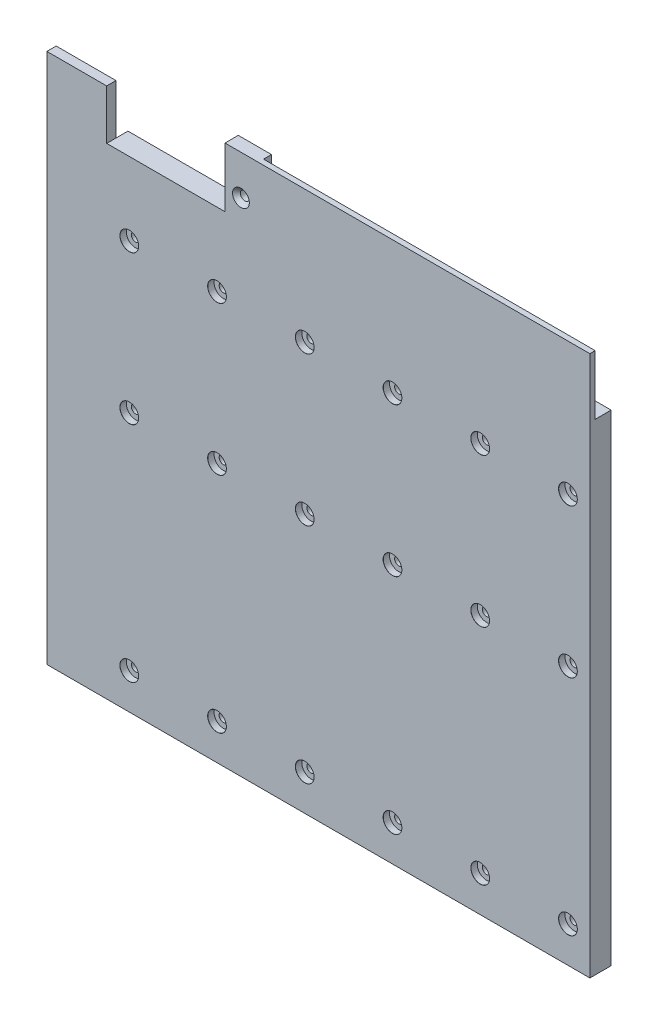
from build123d import *

# Parameters (mm, degrees)
ESQUISSE1_W                                    = 408.5
ESQUISSE1_H                                    = 181
BOSS_EXTRU_1_DEPTH                             = 8
CHAMBRAGE_POUR_VIS_T_TE_RONDE_BOMB_2_COUNT     = 2
CHAMBRAGE_POUR_VIS_T_TE_RONDE_BOMB_2_PITCH     = 56
CHAMBRAGE_POUR_VIS_T_TE_RONDE_BOMB_3_COUNT     = 2
CHAMBRAGE_POUR_VIS_T_TE_RONDE_BOMB_3_PITCH     = 140
R_P_TITION_LIN_AIRE1_COUNT                     = 11
R_P_TITION_LIN_AIRE1_PITCH                     = 33
ENL_V_MAT_EXTRU_1_REACH                        = 275.026
ESQUISSE6_W                                    = 22.5
ESQUISSE6_H                                    = 4.5
BOSS_EXTRU_2_START                             = -3.5
ESQUISSE7_W                                    = 22.5
ESQUISSE7_H                                    = 18.725
BOSS_EXTRU_2_DEPTH                             = 3.5
ESQUISSE8_W                                    = 274.5
ESQUISSE8_H                                    = 22.375
BOSS_EXTRU_3_DEPTH                             = 5
FRAISAGE_POUR_VIS_T_TE_FRAIS_E_M31_D           = 3.4
FRAISAGE_POUR_VIS_T_TE_FRAIS_E_M31_CSINK_D     = 6.3
FRAISAGE_POUR_VIS_T_TE_FRAIS_E_M31_CSINK_ANGLE = 90
ESQUISSE12_W                                   = 249.5
ESQUISSE12_H                                   = 22.375
ENL_V_MAT_EXTRU_2_DEPTH                        = 3
ESQUISSE13_W                                   = 204.25
ESQUISSE13_H                                   = 203.375
ENL_V_MAT_EXTRU_3_DEPTH                        = 10


with BuildPart() as part:
    # Esquisse1 → Boss.-Extru.1 (new body)
    with BuildSketch(Plane.XY):
        Rectangle(ESQUISSE1_W, ESQUISSE1_H)
    extrude(amount=BOSS_EXTRU_1_DEPTH)

    # Esquisse3 → Chambrage pour vis à tête ronde bombée M31 (revolve, cut)
    with BuildSketch(Plane(origin=(-173.25, 63, 8), x_dir=(0, -1, 0), z_dir=(1, 0, 0))):
        Polygon((0, 0), (0, 8), (1.6, 8), (1.6, 2.4), (3.5, 2.4), (3.5, 0.025), (3.525, 0), align=None)
    chambrage_pour_vis_t_te_ronde_bomb_e_m = revolve(axis=Axis((-173.25, 63, 14.35), (0, 0, -1)), mode=Mode.SUBTRACT)

    # Chambrage pour vis _ t_te ronde bomb 2: Chambrage pour vis à tête ronde bombée M31 ×2
    with Locations(*[(0, -i * CHAMBRAGE_POUR_VIS_T_TE_RONDE_BOMB_2_PITCH, 0) for i in range(1, CHAMBRAGE_POUR_VIS_T_TE_RONDE_BOMB_2_COUNT)]):
        add(chambrage_pour_vis_t_te_ronde_bomb_e_m, mode=Mode.SUBTRACT)

    # Chambrage pour vis _ t_te ronde bomb 3: Chambrage pour vis à tête ronde bombée M31 ×2
    with Locations(*[(0, -i * CHAMBRAGE_POUR_VIS_T_TE_RONDE_BOMB_3_PITCH, 0) for i in range(1, CHAMBRAGE_POUR_VIS_T_TE_RONDE_BOMB_3_COUNT)]):
        add(chambrage_pour_vis_t_te_ronde_bomb_e_m, mode=Mode.SUBTRACT)

    # Répétition linéaire1: Chambrage pour vis à tête ronde bombée M31 ×11
    with Locations(*[(i * R_P_TITION_LIN_AIRE1_PITCH, 0, 0) for i in range(1, R_P_TITION_LIN_AIRE1_COUNT)]):
        add(chambrage_pour_vis_t_te_ronde_bomb_e_m, mode=Mode.SUBTRACT)

    # Répétition linéaire1 copy 1 sketch → Répétition linéaire1 copy 1 (revolve, cut)
    with BuildSketch(Plane(origin=(-140.25, 7, 8), x_dir=(0, -1, 0), z_dir=(1, 0, 0))):
        Polygon((0, 0), (0, 8), (1.6, 8), (1.6, 2.4), (3.5, 2.4), (3.5, 0.025), (3.525, 0), align=None)
    revolve(axis=Axis((-140.25, 7, 14.35), (0, 0, -1)), mode=Mode.SUBTRACT)

    # Répétition linéaire1 copy 2 sketch → Répétition linéaire1 copy 2 (revolve, cut)
    with BuildSketch(Plane(origin=(-107.25, 7, 8), x_dir=(0, -1, 0), z_dir=(1, 0, 0))):
        Polygon((0, 0), (0, 8), (1.6, 8), (1.6, 2.4), (3.5, 2.4), (3.5, 0.025), (3.525, 0), align=None)
    revolve(axis=Axis((-107.25, 7, 14.35), (0, 0, -1)), mode=Mode.SUBTRACT)

    # Répétition linéaire1 copy 3 sketch → Répétition linéaire1 copy 3 (revolve, cut)
    with BuildSketch(Plane(origin=(-74.25, 7, 8), x_dir=(0, -1, 0), z_dir=(1, 0, 0))):
        Polygon((0, 0), (0, 8), (1.6, 8), (1.6, 2.4), (3.5, 2.4), (3.5, 0.025), (3.525, 0), align=None)
    revolve(axis=Axis((-74.25, 7, 14.35), (0, 0, -1)), mode=Mode.SUBTRACT)

    # Répétition linéaire1 copy 4 sketch → Répétition linéaire1 copy 4 (revolve, cut)
    with BuildSketch(Plane(origin=(-41.25, 7, 8), x_dir=(0, -1, 0), z_dir=(1, 0, 0))):
        Polygon((0, 0), (0, 8), (1.6, 8), (1.6, 2.4), (3.5, 2.4), (3.5, 0.025), (3.525, 0), align=None)
    revolve(axis=Axis((-41.25, 7, 14.35), (0, 0, -1)), mode=Mode.SUBTRACT)

    # Répétition linéaire1 copy 5 sketch → Répétition linéaire1 copy 5 (revolve, cut)
    with BuildSketch(Plane(origin=(-8.25, 7, 8), x_dir=(0, -1, 0), z_dir=(1, 0, 0))):
        Polygon((0, 0), (0, 8), (1.6, 8), (1.6, 2.4), (3.5, 2.4), (3.5, 0.025), (3.525, 0), align=None)
    revolve(axis=Axis((-8.25, 7, 14.35), (0, 0, -1)), mode=Mode.SUBTRACT)

    # Répétition linéaire1 copy 6 sketch → Répétition linéaire1 copy 6 (revolve, cut)
    with BuildSketch(Plane(origin=(24.75, 7, 8), x_dir=(0, -1, 0), z_dir=(1, 0, 0))):
        Polygon((0, 0), (0, 8), (1.6, 8), (1.6, 2.4), (3.5, 2.4), (3.5, 0.025), (3.525, 0), align=None)
    revolve(axis=Axis((24.75, 7, 14.35), (0, 0, -1)), mode=Mode.SUBTRACT)

    # Répétition linéaire1 copy 7 sketch → Répétition linéaire1 copy 7 (revolve, cut)
    with BuildSketch(Plane(origin=(57.75, 7, 8), x_dir=(0, -1, 0), z_dir=(1, 0, 0))):
        Polygon((0, 0), (0, 8), (1.6, 8), (1.6, 2.4), (3.5, 2.4), (3.5, 0.025), (3.525, 0), align=None)
    revolve(axis=Axis((57.75, 7, 14.35), (0, 0, -1)), mode=Mode.SUBTRACT)

    # Répétition linéaire1 copy 8 sketch → Répétition linéaire1 copy 8 (revolve, cut)
    with BuildSketch(Plane(origin=(90.75, 7, 8), x_dir=(0, -1, 0), z_dir=(1, 0, 0))):
        Polygon((0, 0), (0, 8), (1.6, 8), (1.6, 2.4), (3.5, 2.4), (3.5, 0.025), (3.525, 0), align=None)
    revolve(axis=Axis((90.75, 7, 14.35), (0, 0, -1)), mode=Mode.SUBTRACT)

    # Répétition linéaire1 copy 9 sketch → Répétition linéaire1 copy 9 (revolve, cut)
    with BuildSketch(Plane(origin=(123.75, 7, 8), x_dir=(0, -1, 0), z_dir=(1, 0, 0))):
        Polygon((0, 0), (0, 8), (1.6, 8), (1.6, 2.4), (3.5, 2.4), (3.5, 0.025), (3.525, 0), align=None)
    revolve(axis=Axis((123.75, 7, 14.35), (0, 0, -1)), mode=Mode.SUBTRACT)

    # Répétition linéaire1 copy 10 sketch → Répétition linéaire1 copy 10 (revolve, cut)
    with BuildSketch(Plane(origin=(156.75, 7, 8), x_dir=(0, -1, 0), z_dir=(1, 0, 0))):
        Polygon((0, 0), (0, 8), (1.6, 8), (1.6, 2.4), (3.5, 2.4), (3.5, 0.025), (3.525, 0), align=None)
    revolve(axis=Axis((156.75, 7, 14.35), (0, 0, -1)), mode=Mode.SUBTRACT)

    # Répétition linéaire1 copy 11 sketch → Répétition linéaire1 copy 11 (revolve, cut)
    with BuildSketch(Plane(origin=(-140.25, -77, 8), x_dir=(0, -1, 0), z_dir=(1, 0, 0))):
        Polygon((0, 0), (0, 8), (1.6, 8), (1.6, 2.4), (3.5, 2.4), (3.5, 0.025), (3.525, 0), align=None)
    revolve(axis=Axis((-140.25, -77, 14.35), (0, 0, -1)), mode=Mode.SUBTRACT)

    # Répétition linéaire1 copy 12 sketch → Répétition linéaire1 copy 12 (revolve, cut)
    with BuildSketch(Plane(origin=(-107.25, -77, 8), x_dir=(0, -1, 0), z_dir=(1, 0, 0))):
        Polygon((0, 0), (0, 8), (1.6, 8), (1.6, 2.4), (3.5, 2.4), (3.5, 0.025), (3.525, 0), align=None)
    revolve(axis=Axis((-107.25, -77, 14.35), (0, 0, -1)), mode=Mode.SUBTRACT)

    # Répétition linéaire1 copy 13 sketch → Répétition linéaire1 copy 13 (revolve, cut)
    with BuildSketch(Plane(origin=(-74.25, -77, 8), x_dir=(0, -1, 0), z_dir=(1, 0, 0))):
        Polygon((0, 0), (0, 8), (1.6, 8), (1.6, 2.4), (3.5, 2.4), (3.5, 0.025), (3.525, 0), align=None)
    revolve(axis=Axis((-74.25, -77, 14.35), (0, 0, -1)), mode=Mode.SUBTRACT)

    # Répétition linéaire1 copy 14 sketch → Répétition linéaire1 copy 14 (revolve, cut)
    with BuildSketch(Plane(origin=(-41.25, -77, 8), x_dir=(0, -1, 0), z_dir=(1, 0, 0))):
        Polygon((0, 0), (0, 8), (1.6, 8), (1.6, 2.4), (3.5, 2.4), (3.5, 0.025), (3.525, 0), align=None)
    revolve(axis=Axis((-41.25, -77, 14.35), (0, 0, -1)), mode=Mode.SUBTRACT)

    # Répétition linéaire1 copy 15 sketch → Répétition linéaire1 copy 15 (revolve, cut)
    with BuildSketch(Plane(origin=(-8.25, -77, 8), x_dir=(0, -1, 0), z_dir=(1, 0, 0))):
        Polygon((0, 0), (0, 8), (1.6, 8), (1.6, 2.4), (3.5, 2.4), (3.5, 0.025), (3.525, 0), align=None)
    revolve(axis=Axis((-8.25, -77, 14.35), (0, 0, -1)), mode=Mode.SUBTRACT)

    # Répétition linéaire1 copy 16 sketch → Répétition linéaire1 copy 16 (revolve, cut)
    with BuildSketch(Plane(origin=(24.75, -77, 8), x_dir=(0, -1, 0), z_dir=(1, 0, 0))):
        Polygon((0, 0), (0, 8), (1.6, 8), (1.6, 2.4), (3.5, 2.4), (3.5, 0.025), (3.525, 0), align=None)
    revolve(axis=Axis((24.75, -77, 14.35), (0, 0, -1)), mode=Mode.SUBTRACT)

    # Répétition linéaire1 copy 17 sketch → Répétition linéaire1 copy 17 (revolve, cut)
    with BuildSketch(Plane(origin=(57.75, -77, 8), x_dir=(0, -1, 0), z_dir=(1, 0, 0))):
        Polygon((0, 0), (0, 8), (1.6, 8), (1.6, 2.4), (3.5, 2.4), (3.5, 0.025), (3.525, 0), align=None)
    revolve(axis=Axis((57.75, -77, 14.35), (0, 0, -1)), mode=Mode.SUBTRACT)

    # Répétition linéaire1 copy 18 sketch → Répétition linéaire1 copy 18 (revolve, cut)
    with BuildSketch(Plane(origin=(90.75, -77, 8), x_dir=(0, -1, 0), z_dir=(1, 0, 0))):
        Polygon((0, 0), (0, 8), (1.6, 8), (1.6, 2.4), (3.5, 2.4), (3.5, 0.025), (3.525, 0), align=None)
    revolve(axis=Axis((90.75, -77, 14.35), (0, 0, -1)), mode=Mode.SUBTRACT)

    # Répétition linéaire1 copy 19 sketch → Répétition linéaire1 copy 19 (revolve, cut)
    with BuildSketch(Plane(origin=(123.75, -77, 8), x_dir=(0, -1, 0), z_dir=(1, 0, 0))):
        Polygon((0, 0), (0, 8), (1.6, 8), (1.6, 2.4), (3.5, 2.4), (3.5, 0.025), (3.525, 0), align=None)
    revolve(axis=Axis((123.75, -77, 14.35), (0, 0, -1)), mode=Mode.SUBTRACT)

    # Répétition linéaire1 copy 20 sketch → Répétition linéaire1 copy 20 (revolve, cut)
    with BuildSketch(Plane(origin=(156.75, -77, 8), x_dir=(0, -1, 0), z_dir=(1, 0, 0))):
        Polygon((0, 0), (0, 8), (1.6, 8), (1.6, 2.4), (3.5, 2.4), (3.5, 0.025), (3.525, 0), align=None)
    revolve(axis=Axis((156.75, -77, 14.35), (0, 0, -1)), mode=Mode.SUBTRACT)

    # Esquisse6 → Enlèv. mat.-Extru.1 (cut, up to next)
    with BuildSketch(Plane(origin=(0, 90.5, 0), x_dir=(1, 0, 0), z_dir=(0, 1, 0)), mode=Mode.PRIVATE) as enl_v_mat_extru_1_sk1:
        with Locations((-193, -2.25)):
            Rectangle(ESQUISSE6_W, ESQUISSE6_H)
    enl_v_mat_extru_1_tool1 = extrude(enl_v_mat_extru_1_sk1.sketch, amount=-ENL_V_MAT_EXTRU_1_REACH, mode=Mode.PRIVATE) & part.part
    # Esquisse6 → Enlèv. mat.-Extru.1 (cut, up to next)
    with BuildSketch(Plane(origin=(0, 90.5, 0), x_dir=(1, 0, 0), z_dir=(0, 1, 0)), mode=Mode.PRIVATE) as enl_v_mat_extru_1_sk2:
        with Locations((193, -2.25)):
            Rectangle(ESQUISSE6_W, ESQUISSE6_H)
    enl_v_mat_extru_1_tool2 = extrude(enl_v_mat_extru_1_sk2.sketch, amount=-ENL_V_MAT_EXTRU_1_REACH, mode=Mode.PRIVATE) & part.part
    add(enl_v_mat_extru_1_tool1.solids().sort_by_distance((-193, 90.5, 2.25))[0], mode=Mode.SUBTRACT)
    add(enl_v_mat_extru_1_tool2.solids().sort_by_distance((193, 90.5, 2.25))[0], mode=Mode.SUBTRACT)

    # Esquisse7 → Boss.-Extru.2 (add)
    with BuildSketch(Plane.XY.offset(8).offset(BOSS_EXTRU_2_START)):
        with Locations((-193, 99.8625)):
            Rectangle(ESQUISSE7_W, ESQUISSE7_H)
    boss_extru_2 = extrude(amount=BOSS_EXTRU_2_DEPTH)

    # Symétrie1: Boss.-Extru.2 across plane
    add(boss_extru_2.mirror(Plane(origin=(0, 0, 0), x_dir=(0, 0, 1), z_dir=(1, 0, 0))))

    # Esquisse8 → Boss.-Extru.3 (add)
    with BuildSketch(Plane.XY.offset(8)):
        with Locations((0, 101.6875)):
            Rectangle(ESQUISSE8_W, ESQUISSE8_H)
    extrude(amount=-BOSS_EXTRU_3_DEPTH)

    # Fraisage pour vis à tête fraisée M31 (through all)
    with Locations(Plane.XY.offset(8)):
        with Locations((-131.25, 98), (131.25, 98)):
            CounterSinkHole(FRAISAGE_POUR_VIS_T_TE_FRAIS_E_M31_D / 2, FRAISAGE_POUR_VIS_T_TE_FRAIS_E_M31_CSINK_D / 2, counter_sink_angle=FRAISAGE_POUR_VIS_T_TE_FRAIS_E_M31_CSINK_ANGLE)

    # Esquisse12 → Enlèv. mat.-Extru.2 (cut)
    with BuildSketch(Plane(origin=(0, 0, 3), x_dir=(-1, 0, 0), z_dir=(0, 0, -1))):
        with Locations((0, 101.6875)):
            Rectangle(ESQUISSE12_W, ESQUISSE12_H)
    extrude(amount=-ENL_V_MAT_EXTRU_2_DEPTH, mode=Mode.SUBTRACT)

    # Esquisse13 → Enlèv. mat.-Extru.3 (cut)
    with BuildSketch(Plane(origin=(0, 0, 0), x_dir=(-1, 0, 0), z_dir=(0, 0, -1))):
        with Locations((-102.125, 11.1875)):
            Rectangle(ESQUISSE13_W, ESQUISSE13_H)
    extrude(amount=-ENL_V_MAT_EXTRU_3_DEPTH, mode=Mode.SUBTRACT)


solid = part.part
